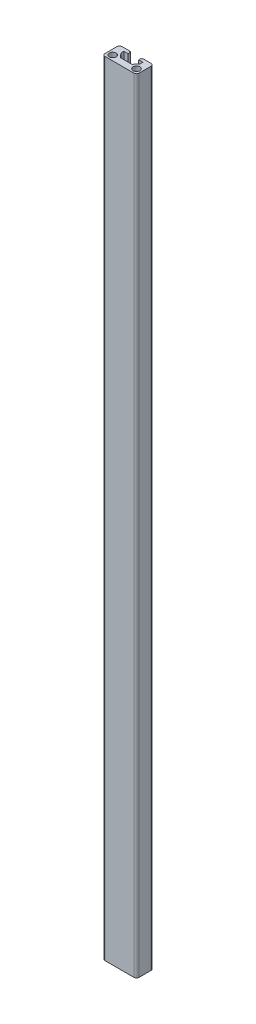
from build123d import *

# Parameters (mm, degrees)
SKETCH_1_R      = 2
EXTRUDE_1_DEPTH = 460
FILLET_1_R      = 1.5


with BuildPart() as part:
    # 草图1 → 凸台-拉伸1 (new body)
    with BuildSketch(Plane(origin=(0, 0, 0), x_dir=(1, 0, 0), z_dir=(0, 1, 0))):
        Polygon((0, 0), (20, 0), (20, 10), (13.65, 10), (13.65, 9.510427602), (13.1, 9.510427602), (13.1, 8.2), (15.6, 8.2), (15.6, 6.447507136), (13.412706863, 3.9), (6.587293137, 3.9), (4.4, 6.447507136), (4.4, 8.2), (6.9, 8.2), (6.9, 9.510427602), (6.35, 9.510427602), (6.35, 10), (0, 10), align=None)
        with Locations(Location((3, 3, 0), (0, 0, 270))):
            Circle(SKETCH_1_R, mode=Mode.SUBTRACT)
        with Locations(Location((17, 3, 0), (0, 0, 270))):
            Circle(SKETCH_1_R, mode=Mode.SUBTRACT)
    extrude(amount=EXTRUDE_1_DEPTH)

    # 圆角1
    fillet_1_edges = [part.edges().sort_by_distance(p)[0] for p in [
        (0, 230, -10),
        (20, 230, -10),
        (20, 230, 0),
        (0, 230, 0),
    ]]
    fillet(fillet_1_edges, radius=FILLET_1_R)


solid = part.part
